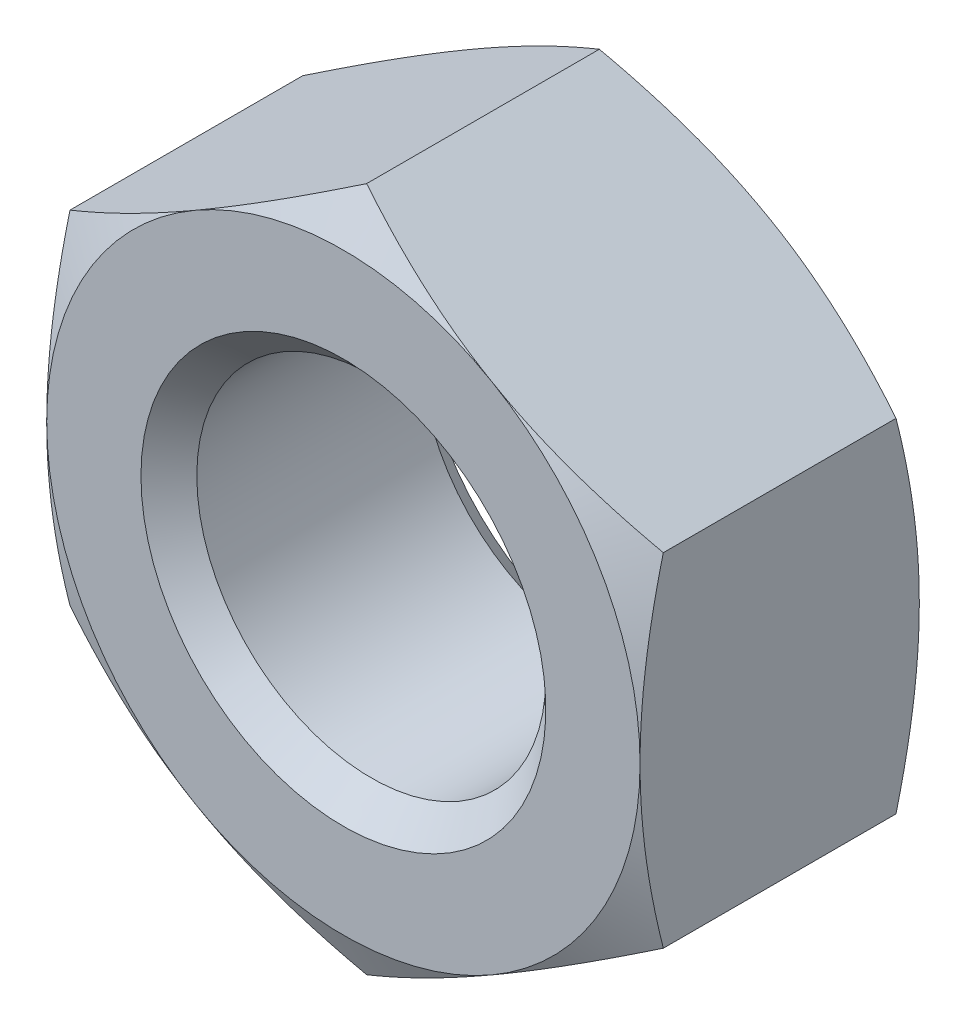
from build123d import *

# Parameters (mm, degrees)
SKETCH1_R           = 5
BOSS_EXTRUDE1_DEPTH = 8


with BuildPart() as part:
    # Sketch1 → Boss-Extrude1 (new body)
    with BuildSketch(Plane.XY):
        Polygon((0, -9.814954576), (8.5, -4.907477288), (8.5, 4.907477288), (0, 9.814954576), (-8.5, 4.907477288), (-8.5, -4.907477288), align=None)
        Circle(SKETCH1_R, mode=Mode.SUBTRACT)
    extrude(amount=BOSS_EXTRUDE1_DEPTH)

    # Sketch2 → Cut-Revolve1 (revolve, cut)
    with BuildSketch(Plane(origin=(0, 0, 0), x_dir=(0, 0, -1), z_dir=(1, 0, 0)), mode=Mode.PRIVATE) as cut_revolve1_sk:
        Polygon((-8, 9.814954576), (-8, 8.5), (-7.333333333, 9.814954576), align=None)
        Polygon((-0.666666667, 9.814954576), (0, 9.814954576), (0, 8.5), align=None)
        Polygon((-8, 5), (-7.2, 5), (-8, 5.8), align=None)
        Polygon((0, 5), (-0.8, 5), (0, 5.8), align=None)
    revolve(cut_revolve1_sk.sketch.rotate(Axis((0, 0, 0), (0, 0, 1)), 90), axis=Axis((0, 0, 0), (0, 0, 1)), mode=Mode.SUBTRACT)


solid = part.part
